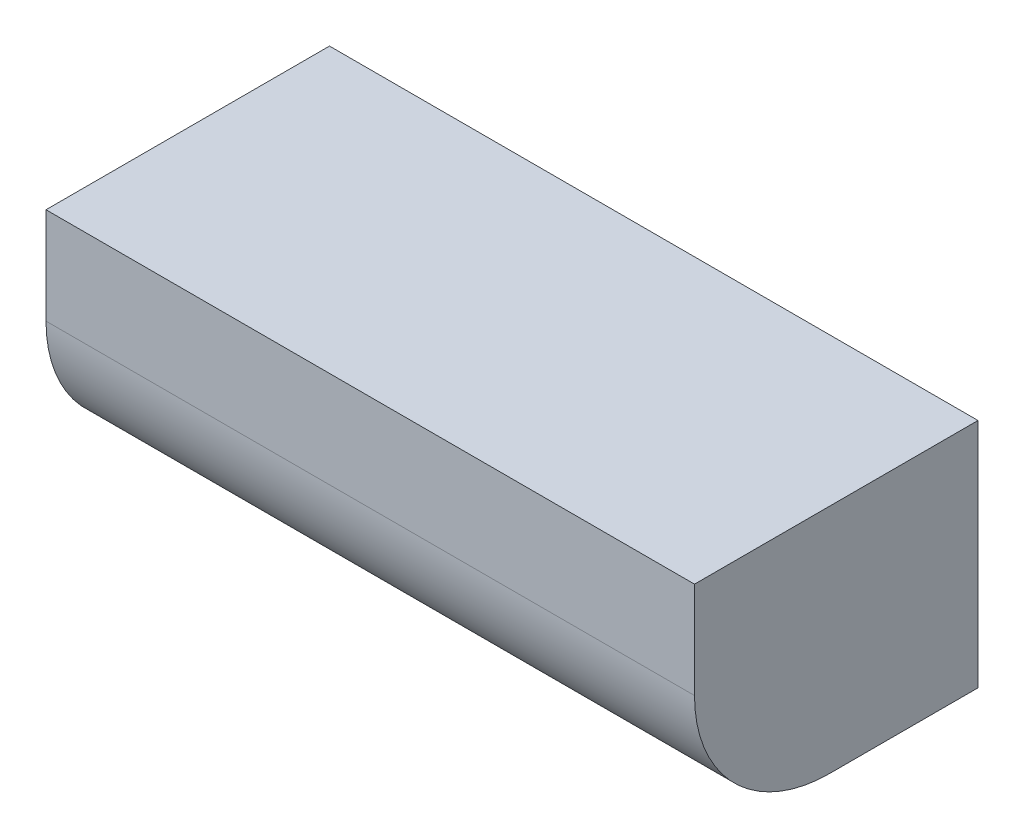
from build123d import *

# Parameters (mm, degrees)
SKETCH1_W            = 48
SKETCH1_H            = 53
BOSS_EXTRUDE1_DEPTH  = 10
SKETCH2_W            = 48
SKETCH2_H            = 5.616325
BOSS_EXTRUDE2_DEPTH  = 33.1917878
SKETCH4_W            = 4
SKETCH4_H            = 10
BOSS_EXTRUDE4_DEPTH  = 40
SKETCH5_W            = 48
SKETCH5_H            = 10.8609375
BOSS_EXTRUDE5_DEPTH  = 23.1917878
SKETCH6_W            = 48
SKETCH6_H            = 5
BOSS_EXTRUDE6_DEPTH  = 42.3
SKETCH7_W            = 12.8082122
SKETCH7_H            = 16.4772625
BOSS_EXTRUDE7_DEPTH  = 48
CUT_EXTRUDE1_REACH   = 84.426
SKETCH8_R            = 11.5
SKETCH8_R_2          = 2
FILLET1_R            = 10
FILLET2_R            = 4
SKETCH9_W            = 5
SKETCH9_H            = 16.4772625
BOSS_EXTRUDE9_DEPTH  = 48
CUT_EXTRUDE2_DEPTH   = 6
SKETCH11_R           = 1.9304
CUT_EXTRUDE3_DEPTH   = 6
BOSS_EXTRUDE11_DEPTH = 3
BOSS_EXTRUDE12_DEPTH = 48
SKETCH14_W           = 119.824941969
SKETCH14_H           = 122.237524693
CUT_EXTRUDE4_DEPTH   = 90.10667764
SKETCH15_W           = 48
SKETCH15_H           = 17.1390625
BOSS_EXTRUDE13_DEPTH = 3.175


with BuildPart() as part:
    # Sketch1 → Boss-Extrude1 (new body)
    with BuildSketch(Plane.XY):
        with Locations((24, 26.5)):
            Rectangle(SKETCH1_W, SKETCH1_H)
    extrude(amount=BOSS_EXTRUDE1_DEPTH)

    # Sketch2 → Boss-Extrude2 (add)
    with BuildSketch(Plane(origin=(0, 0, 0), x_dir=(-1, 0, 0), z_dir=(0, 0, -1))):
        with Locations((-24, -2.8081625)):
            Rectangle(SKETCH2_W, SKETCH2_H)
    extrude(amount=-BOSS_EXTRUDE2_DEPTH)

    # Sketch4 → Boss-Extrude4 (add)
    with BuildSketch(Plane.XY.offset(10)):
        with Locations((2, 48)):
            Rectangle(SKETCH4_W, SKETCH4_H)
        with Locations((46, 48)):
            Rectangle(SKETCH4_W, SKETCH4_H)
    extrude(amount=BOSS_EXTRUDE4_DEPTH)

    # Sketch5 → Boss-Extrude5 (add)
    with BuildSketch(Plane.XY.offset(10)):
        with Locations((24, 5.43046875)):
            Rectangle(SKETCH5_W, SKETCH5_H)
    extrude(amount=BOSS_EXTRUDE5_DEPTH)

    # Sketch6 → Boss-Extrude6 (add)
    with BuildSketch(Plane.XZ.offset(5.616325)):
        with Locations((24, 30.6917878)):
            Rectangle(SKETCH6_W, SKETCH6_H)
    extrude(amount=BOSS_EXTRUDE6_DEPTH)

    # Sketch7 → Boss-Extrude7 (add)
    with BuildSketch(Plane.ZY):
        with Locations((-6.4041061, 2.62230625)):
            Rectangle(SKETCH7_W, SKETCH7_H)
    extrude(amount=-BOSS_EXTRUDE7_DEPTH)

    # Sketch8 → Cut-Extrude1 (cut, up to next)
    with BuildSketch(Plane(origin=(0, 0, 28.1917878), x_dir=(-1, 0, 0), z_dir=(0, 0, -1)), mode=Mode.PRIVATE) as cut_extrude1_sk1:
        with Locations((-24, -26.616325)):
            Circle(SKETCH8_R)
    cut_extrude1_tool1 = extrude(cut_extrude1_sk1.sketch, amount=-CUT_EXTRUDE1_REACH, mode=Mode.PRIVATE) & part.part
    # Sketch8 → Cut-Extrude1 (cut, up to next)
    with BuildSketch(Plane(origin=(0, 0, 28.1917878), x_dir=(-1, 0, 0), z_dir=(0, 0, -1)), mode=Mode.PRIVATE) as cut_extrude1_sk2:
        with Locations((-39.5, -11.116325)):
            Circle(SKETCH8_R_2)
    cut_extrude1_tool2 = extrude(cut_extrude1_sk2.sketch, amount=-CUT_EXTRUDE1_REACH, mode=Mode.PRIVATE) & part.part
    # Sketch8 → Cut-Extrude1 (cut, up to next)
    with BuildSketch(Plane(origin=(0, 0, 28.1917878), x_dir=(-1, 0, 0), z_dir=(0, 0, -1)), mode=Mode.PRIVATE) as cut_extrude1_sk3:
        with Locations((-39.5, -42.116325)):
            Circle(SKETCH8_R_2)
    cut_extrude1_tool3 = extrude(cut_extrude1_sk3.sketch, amount=-CUT_EXTRUDE1_REACH, mode=Mode.PRIVATE) & part.part
    # Sketch8 → Cut-Extrude1 (cut, up to next)
    with BuildSketch(Plane(origin=(0, 0, 28.1917878), x_dir=(-1, 0, 0), z_dir=(0, 0, -1)), mode=Mode.PRIVATE) as cut_extrude1_sk4:
        with Locations((-8.5, -11.116325)):
            Circle(SKETCH8_R_2)
    cut_extrude1_tool4 = extrude(cut_extrude1_sk4.sketch, amount=-CUT_EXTRUDE1_REACH, mode=Mode.PRIVATE) & part.part
    # Sketch8 → Cut-Extrude1 (cut, up to next)
    with BuildSketch(Plane(origin=(0, 0, 28.1917878), x_dir=(-1, 0, 0), z_dir=(0, 0, -1)), mode=Mode.PRIVATE) as cut_extrude1_sk5:
        with Locations((-8.5, -42.116325)):
            Circle(SKETCH8_R_2)
    cut_extrude1_tool5 = extrude(cut_extrude1_sk5.sketch, amount=-CUT_EXTRUDE1_REACH, mode=Mode.PRIVATE) & part.part
    add(cut_extrude1_tool1.solids().sort_by_distance((24, -26.616325, 28.191788))[0], mode=Mode.SUBTRACT)
    add(cut_extrude1_tool2.solids().sort_by_distance((39.5, -11.116325, 28.191788))[0], mode=Mode.SUBTRACT)
    add(cut_extrude1_tool3.solids().sort_by_distance((39.5, -42.116325, 28.191788))[0], mode=Mode.SUBTRACT)
    add(cut_extrude1_tool4.solids().sort_by_distance((8.5, -11.116325, 28.191788))[0], mode=Mode.SUBTRACT)
    add(cut_extrude1_tool5.solids().sort_by_distance((8.5, -42.116325, 28.191788))[0], mode=Mode.SUBTRACT)

    # Fillet1
    fillet1_edges = [part.edges().sort_by_distance(p)[0] for p in [
        (24, 10.8609375, 0),
    ]]
    fillet(fillet1_edges, radius=FILLET1_R)

    # Fillet2
    fillet2_edges = [part.edges().sort_by_distance(p)[0] for p in [
        (2, 43, 10),
        (46, 43, 10),
    ]]
    fillet(fillet2_edges, radius=FILLET2_R)

    # Sketch9 → Boss-Extrude9 (add)
    with BuildSketch(Plane(origin=(48, 0, 0), x_dir=(0, 0, -1), z_dir=(1, 0, 0))):
        with Locations((15.3082122, 2.62230625)):
            Rectangle(SKETCH9_W, SKETCH9_H)
    extrude(amount=-BOSS_EXTRUDE9_DEPTH)

    # Sketch10 → Cut-Extrude2 (cut)
    with BuildSketch(Plane.XY.offset(10)):
        Polygon((12.429, 36.979734073), (9, 38.959468146), (5.571, 36.979734073), (5.571, 33.020265927), (9, 31.040531854), (12.429, 33.020265927), align=None)
        Polygon((35.571, 36.979734073), (35.571, 33.020265927), (39, 31.040531854), (42.429, 33.020265927), (42.429, 36.979734073), (39, 38.959468146), align=None)
    extrude(amount=-CUT_EXTRUDE2_DEPTH, mode=Mode.SUBTRACT)

    # Sketch11 → Cut-Extrude3 (cut)
    with BuildSketch(Plane.XY.offset(4)):
        with Locations((9, 35)):
            Circle(SKETCH11_R)
        with Locations((39, 35)):
            Circle(SKETCH11_R)
    extrude(amount=-CUT_EXTRUDE3_DEPTH, mode=Mode.SUBTRACT)

    # Sketch12 → Boss-Extrude11 (add)
    with BuildSketch(Plane(origin=(0, 53, 0), x_dir=(1, 0, 0), z_dir=(0, 1, 0))):
        Polygon((0, 0), (0, -50), (4, -50), (4, -10), (44, -10), (44, -50), (48, -50), (48, 0), align=None)
    extrude(amount=BOSS_EXTRUDE11_DEPTH)

    # Sketch13 → Boss-Extrude12 (add)
    with BuildSketch(Plane(origin=(48, 0, 0), x_dir=(0, 0, -1), z_dir=(1, 0, 0))):
        with BuildLine():
            Line((17.8082122, 10.8609375), (10, 10.8609375))
            ThreePointArc((10, 10.8609375), (2.928932188, 13.789869688), (0, 20.8609375))
            Line((0, 20.8609375), (0, 28))
            Line((0, 28), (17.8082122, 28))
            Line((17.8082122, 28), (17.8082122, 10.8609375))
        make_face()
    extrude(amount=-BOSS_EXTRUDE12_DEPTH)

    # Sketch14 → Cut-Extrude4 (cut, through all)
    with BuildSketch(Plane(origin=(48, 0, 0), x_dir=(0, 0, -1), z_dir=(1, 0, 0))):
        with Locations((-16.90365686, 8.216937598)):
            Rectangle(SKETCH14_W, SKETCH14_H)
        with BuildLine():
            Line((0, 28), (0, 20.8609375))
            ThreePointArc((0, 20.8609375), (2.928932188, 13.789869688), (10, 10.8609375))
            Line((10, 10.8609375), (17.8082122, 10.8609375))
            Line((17.8082122, 10.8609375), (17.8082122, 28))
            Line((17.8082122, 28), (0, 28))
        make_face(mode=Mode.SUBTRACT)
    extrude(amount=-CUT_EXTRUDE4_DEPTH, mode=Mode.SUBTRACT)

    # Sketch15 → Boss-Extrude13 (add)
    with BuildSketch(Plane(origin=(0, 0, -17.8082122), x_dir=(-1, 0, 0), z_dir=(0, 0, -1))):
        with Locations((-24, 19.43046875)):
            Rectangle(SKETCH15_W, SKETCH15_H)
    extrude(amount=BOSS_EXTRUDE13_DEPTH)


solid = part.part
